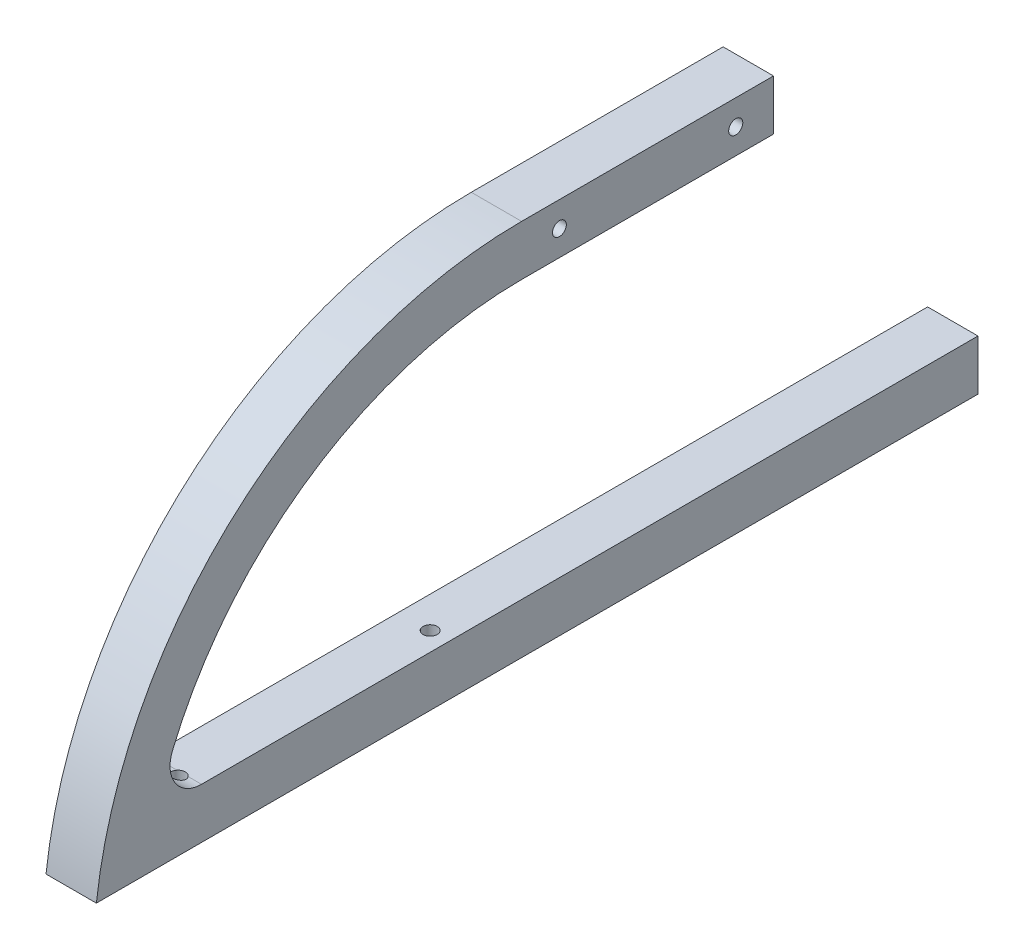
from build123d import *

# Parameters (mm, degrees)
BOSS_EXTRUDE1_DEPTH                               = 10.16
SKETCH2_R                                         = 1.4224
CUT_EXTRUDE2_DEPTH                                = 157.71111347
CUT_EXTRUDE3_REACH                                = 158.711
SKETCH3_R                                         = 1.4224
CSK_FOR_3_FLAT_HEAD_MACHINE_SCREW_100_D           = 2.794
CSK_FOR_3_FLAT_HEAD_MACHINE_SCREW_100_CSINK_D     = 7.7978
CSK_FOR_3_FLAT_HEAD_MACHINE_SCREW_100_CSINK_ANGLE = 82


with BuildPart() as part:
    # Sketch1 → Boss-Extrude1 (new body)
    with BuildSketch(Plane(origin=(0, 0, 0), x_dir=(0, 0, -1), z_dir=(1, 0, 0))):
        with BuildLine():
            Line((-136.560270522, -76.2), (41.239729478, -76.2))
            Line((41.239729478, -76.2), (41.239729478, -66.04))
            Line((41.239729478, -66.04), (-115.357986338, -66.04))
            ThreePointArc((-115.357986338, -66.04), (-120.636166121, -63.220342502), (-121.226894187, -57.265454545))
            ThreePointArc((-121.226894187, -57.265454545), (-93.164110025, -23.021842608), (-50.8, -10.16))
            Line((-50.8, -10.16), (0, -10.16))
            Line((0, -10.16), (0, 0))
            Line((0, 0), (-50.8, 0))
            ThreePointArc((-50.8, 0), (-108.161276136, -21.802013662), (-136.560270522, -76.2))
        make_face()
    extrude(amount=BOSS_EXTRUDE1_DEPTH)

    # Sketch2 → Cut-Extrude2 (cut, through all)
    with BuildSketch(Plane(origin=(10.16, 0, 0), x_dir=(0, 0, -1), z_dir=(1, 0, 0))):
        with Locations((-7.62, -5.08)):
            Circle(SKETCH2_R)
    extrude(amount=-CUT_EXTRUDE2_DEPTH, mode=Mode.SUBTRACT)

    # Sketch3 → Cut-Extrude3 (cut, up to next)
    with BuildSketch(Plane.XZ.offset(76.2), mode=Mode.PRIVATE) as cut_extrude3_sk1:
        with Locations(Location((6.35, 116.240270522, 0), (0, 0, 270))):
            Circle(SKETCH3_R)
    cut_extrude3_tool1 = extrude(cut_extrude3_sk1.sketch, amount=-CUT_EXTRUDE3_REACH, mode=Mode.PRIVATE) & part.part
    # Sketch3 → Cut-Extrude3 (cut, up to next)
    with BuildSketch(Plane.XZ.offset(76.2), mode=Mode.PRIVATE) as cut_extrude3_sk2:
        with Locations(Location((6.35, 65.440270522, 0), (0, 0, 270))):
            Circle(SKETCH3_R)
    cut_extrude3_tool2 = extrude(cut_extrude3_sk2.sketch, amount=-CUT_EXTRUDE3_REACH, mode=Mode.PRIVATE) & part.part
    add(cut_extrude3_tool1.solids().sort_by_distance((6.35, -76.2, 116.240271))[0], mode=Mode.SUBTRACT)
    add(cut_extrude3_tool2.solids().sort_by_distance((6.35, -76.2, 65.440271))[0], mode=Mode.SUBTRACT)

    # CSK for #3 Flat Head Machine Screw (100)1 (through all)
    with Locations(Plane.ZY):
        with Locations((7.62, -5.08)):
            csk_for_3_flat_head_machine_screw_100 = CounterSinkHole(CSK_FOR_3_FLAT_HEAD_MACHINE_SCREW_100_D / 2, CSK_FOR_3_FLAT_HEAD_MACHINE_SCREW_100_CSINK_D / 2, counter_sink_angle=CSK_FOR_3_FLAT_HEAD_MACHINE_SCREW_100_CSINK_ANGLE)

    # Mirror1: CSK for #3 Flat Head Machine Screw (100)1 across plane
    add(csk_for_3_flat_head_machine_screw_100.mirror(Plane(origin=(0, 0, 25.4), x_dir=(1, 0, 0), z_dir=(0, 0, -1))), mode=Mode.SUBTRACT)


solid = part.part
